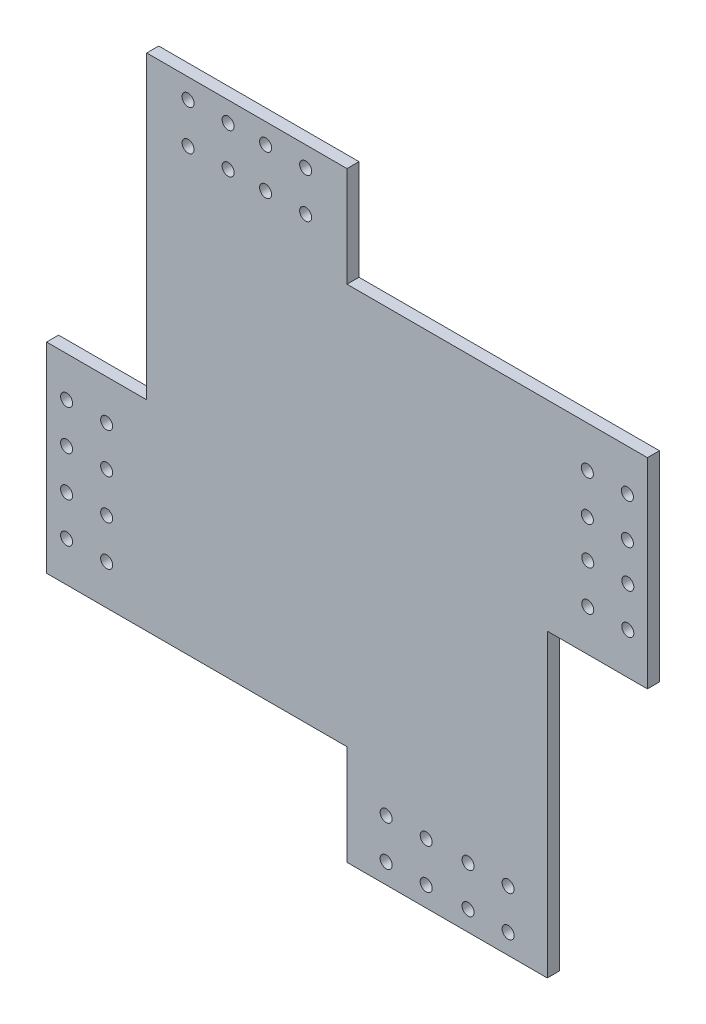
from build123d import *

# Parameters (mm, degrees)
SKETCH_1_R      = 1.5
EXTRUDE_4_DEPTH = 3


with BuildPart() as part:
    # 스케치1 → 보스-돌출4 (new body)
    with BuildSketch(Plane.XY):
        Polygon((50, -25), (50, -75), (50, -100), (0, -100), (0, -75), (-50, -75), (-75, -75), (-75, -25), (-50, -25), (-50, 25), (-50, 50), (0, 50), (0, 25), (75, 25), (75, -25), align=None)
        with Locations(Location((70.106183294, -4.68, 0), (0, 0, 180))):
            Circle(SKETCH_1_R, mode=Mode.SUBTRACT)
        with Locations(Location((60.106183294, -4.68, 0), (0, 0, 180))):
            Circle(SKETCH_1_R, mode=Mode.SUBTRACT)
        with Locations(Location((70.106183294, -14.68, 0), (0, 0, 180))):
            Circle(SKETCH_1_R, mode=Mode.SUBTRACT)
        with Locations(Location((60.106183294, -14.68, 0), (0, 0, 180))):
            Circle(SKETCH_1_R, mode=Mode.SUBTRACT)
        with Locations((9.773310691, -85)):
            Circle(SKETCH_1_R, mode=Mode.SUBTRACT)
        with Locations((19.773310691, -85)):
            Circle(SKETCH_1_R, mode=Mode.SUBTRACT)
        with Locations((9.773310691, -95)):
            Circle(SKETCH_1_R, mode=Mode.SUBTRACT)
        with Locations((19.773310691, -95)):
            Circle(SKETCH_1_R, mode=Mode.SUBTRACT)
        with Locations(Location((40.226689309, -95, 0), (0, 0, 180))):
            Circle(SKETCH_1_R, mode=Mode.SUBTRACT)
        with Locations(Location((30.226689309, -95, 0), (0, 0, 180))):
            Circle(SKETCH_1_R, mode=Mode.SUBTRACT)
        with Locations(Location((30.226689309, -85, 0), (0, 0, 180))):
            Circle(SKETCH_1_R, mode=Mode.SUBTRACT)
        with Locations(Location((40.226689309, -85, 0), (0, 0, 180))):
            Circle(SKETCH_1_R, mode=Mode.SUBTRACT)
        with Locations((-39.680330984, 45)):
            Circle(SKETCH_1_R, mode=Mode.SUBTRACT)
        with Locations((-29.680330984, 45)):
            Circle(SKETCH_1_R, mode=Mode.SUBTRACT)
        with Locations((-39.680330984, 35)):
            Circle(SKETCH_1_R, mode=Mode.SUBTRACT)
        with Locations((-29.680330984, 35)):
            Circle(SKETCH_1_R, mode=Mode.SUBTRACT)
        with Locations(Location((-10.319669016, 35, 0), (0, 0, 180))):
            Circle(SKETCH_1_R, mode=Mode.SUBTRACT)
        with Locations(Location((-20.319669016, 35, 0), (0, 0, 180))):
            Circle(SKETCH_1_R, mode=Mode.SUBTRACT)
        with Locations(Location((-20.319669016, 45, 0), (0, 0, 180))):
            Circle(SKETCH_1_R, mode=Mode.SUBTRACT)
        with Locations(Location((-10.319669016, 45, 0), (0, 0, 180))):
            Circle(SKETCH_1_R, mode=Mode.SUBTRACT)
        with Locations(Location((70, 14.68, 0), (0, 0, 180))):
            Circle(SKETCH_1_R, mode=Mode.SUBTRACT)
        with Locations(Location((60, 14.68, 0), (0, 0, 180))):
            Circle(SKETCH_1_R, mode=Mode.SUBTRACT)
        with Locations(Location((70, 4.68, 0), (0, 0, 180))):
            Circle(SKETCH_1_R, mode=Mode.SUBTRACT)
        with Locations(Location((60, 4.68, 0), (0, 0, 180))):
            Circle(SKETCH_1_R, mode=Mode.SUBTRACT)
        with Locations((-70, -35)):
            Circle(SKETCH_1_R, mode=Mode.SUBTRACT)
        with Locations((-60, -35)):
            Circle(SKETCH_1_R, mode=Mode.SUBTRACT)
        with Locations((-70, -45)):
            Circle(SKETCH_1_R, mode=Mode.SUBTRACT)
        with Locations((-60, -45)):
            Circle(SKETCH_1_R, mode=Mode.SUBTRACT)
        with Locations(Location((-60, -55, 0), (0, 0, 180))):
            Circle(SKETCH_1_R, mode=Mode.SUBTRACT)
        with Locations(Location((-70, -55, 0), (0, 0, 180))):
            Circle(SKETCH_1_R, mode=Mode.SUBTRACT)
        with Locations(Location((-60, -65, 0), (0, 0, 180))):
            Circle(SKETCH_1_R, mode=Mode.SUBTRACT)
        with Locations(Location((-70, -65, 0), (0, 0, 180))):
            Circle(SKETCH_1_R, mode=Mode.SUBTRACT)
    extrude(amount=EXTRUDE_4_DEPTH)


solid = part.part
